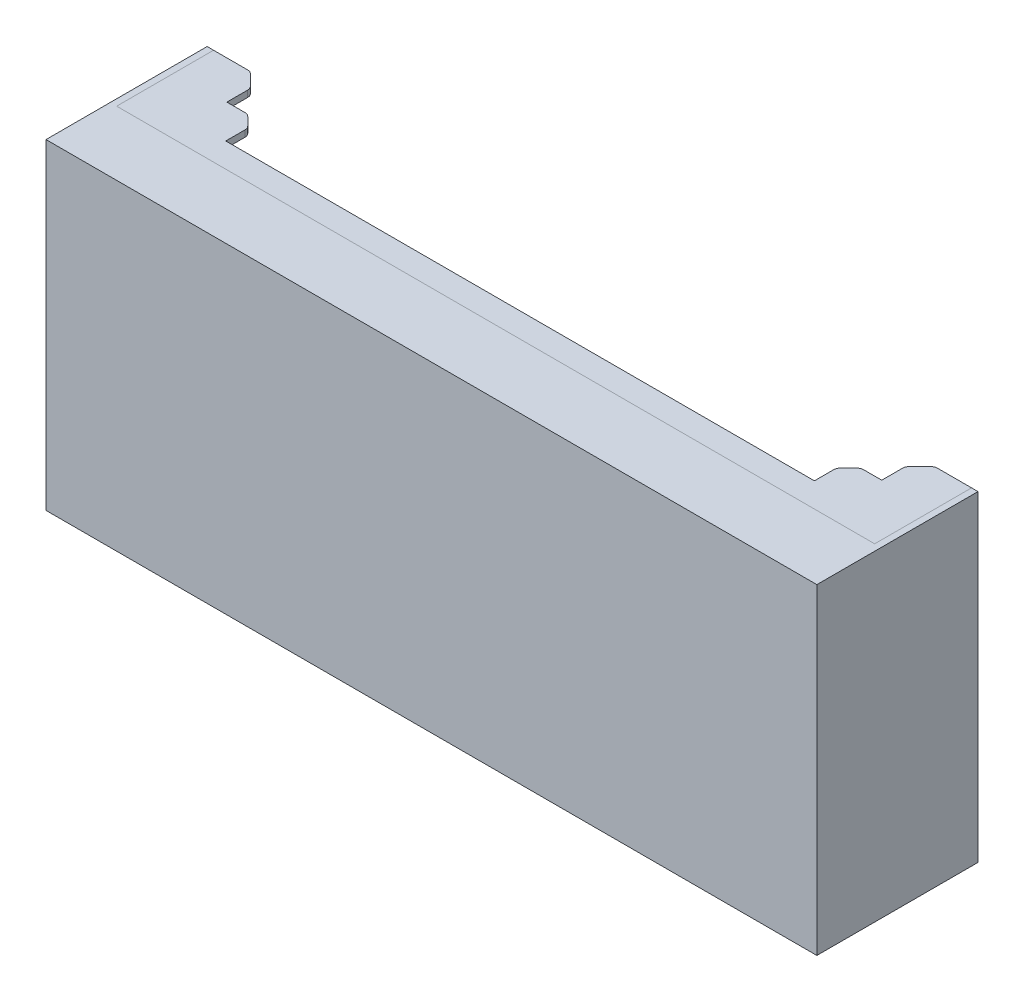
from build123d import *

# Parameters (mm, degrees)
SKETCH2_W            = 120
SKETCH2_H            = 50
BOSS_EXTRUDE1_DEPTH  = 10
SKETCH5_W            = 120
SKETCH5_H            = 1
BOSS_EXTRUDE2_DEPTH  = 15
SKETCH6_W            = 15.086263202
SKETCH6_H            = 50
BOSS_EXTRUDE5_DEPTH  = 1
SKETCH7_W            = 15.086263202
SKETCH7_H            = 50
BOSS_EXTRUDE6_DEPTH  = 1
BOSS_EXTRUDE7_DEPTH  = 1
LPATTERN2_COUNT      = 2
LPATTERN2_PITCH      = 50
FILLET1_R            = 1
FILLET2_R            = 1
SKETCH10_R           = 4
BOSS_EXTRUDE8_DEPTH  = 1
SKETCH11_R           = 4
BOSS_EXTRUDE10_DEPTH = 1
SKETCH12_R           = 1
BOSS_EXTRUDE11_DEPTH = 0.5
SKETCH13_W           = 3.178775998
SKETCH13_H           = 3.223697934
SKETCH13_H_2         = 3.223697935
BOSS_EXTRUDE12_DEPTH = 0.5
BOSS_EXTRUDE13_DEPTH = 3.2
BOSS_EXTRUDE15_DEPTH = 3.2


with BuildPart() as part:
    # Sketch2 → Boss-Extrude1 (new body)
    with BuildSketch(Plane.XY):
        with Locations((-60, 25)):
            Rectangle(SKETCH2_W, SKETCH2_H)
    extrude(amount=BOSS_EXTRUDE1_DEPTH)

    # Sketch5 → Boss-Extrude2 (add)
    with BuildSketch(Plane(origin=(0, 0, 0), x_dir=(-1, 0, 0), z_dir=(0, 0, -1))):
        with Locations((60, 22.926780628)):
            Rectangle(SKETCH5_W, SKETCH5_H)
    extrude(amount=BOSS_EXTRUDE2_DEPTH)

    # Sketch6 → Boss-Extrude5 (add)
    with BuildSketch(Plane(origin=(0, 0, 0), x_dir=(0, 0, -1), z_dir=(1, 0, 0))):
        with Locations((7.543131601, 25)):
            Rectangle(SKETCH6_W, SKETCH6_H)
    extrude(amount=-BOSS_EXTRUDE5_DEPTH)

    # Sketch7 → Boss-Extrude6 (add)
    with BuildSketch(Plane.ZY.offset(120)):
        with Locations((-7.543131601, 25)):
            Rectangle(SKETCH7_W, SKETCH7_H)
    extrude(amount=-BOSS_EXTRUDE6_DEPTH)

    # Sketch10 → Boss-Extrude8 (add)
    with BuildSketch(Plane.ZY.offset(1)):
        with Locations(Location((-7.543131601, 36.713390314, 0), (0, 0, 180))):
            Circle(SKETCH10_R)
    extrude(amount=BOSS_EXTRUDE8_DEPTH)

    # Sketch11 → Boss-Extrude10 (add)
    with BuildSketch(Plane.ZY.offset(1)):
        with Locations(Location((-7.5215658, 11.213390314, 0), (0, 0, 180))):
            Circle(SKETCH11_R)
    extrude(amount=BOSS_EXTRUDE10_DEPTH)

    # Sketch12 → Boss-Extrude11 (add)
    with BuildSketch(Plane.ZY.offset(2)):
        with Locations((-7.543131601, 36.713390314)):
            Circle(SKETCH12_R)
        with Locations((-7.5215658, 11.213390314)):
            Circle(SKETCH12_R)
    extrude(amount=BOSS_EXTRUDE11_DEPTH)

    # Sketch13 → Boss-Extrude12 (add)
    with BuildSketch(Plane(origin=(-119, 0, 0), x_dir=(0, 0, -1), z_dir=(1, 0, 0))):
        with Locations((9.116474982, 37.875113353)):
            Rectangle(SKETCH13_W, SKETCH13_H)
        with Locations((9.089387999, 13.602585939)):
            Rectangle(SKETCH13_W, SKETCH13_H_2)
    extrude(amount=BOSS_EXTRUDE12_DEPTH)

    # Sketch14 → Boss-Extrude13 (add)
    with BuildSketch(Plane(origin=(0, 39.48696232, 0), x_dir=(1, 0, 0), z_dir=(0, 1, 0))):
        Polygon((-118.5, 10.705862981), (-118.03582127, 10.40955065), (-118.03582127, 9.44156523), (-118.03582127, 8.346630902), (-118.5, 8.346630902), align=None)
    extrude(amount=-BOSS_EXTRUDE13_DEPTH)

    # Sketch15 → Boss-Extrude15 (add)
    with BuildSketch(Plane.XZ.offset(-11.990736971)):
        Polygon((-118.5, -10.678775998), (-118.5, -8.318775998), (-118.142191313, -8.618775998), (-118.142191313, -10.678775998), align=None)
    extrude(amount=-BOSS_EXTRUDE15_DEPTH)


with BuildPart() as body_2:
    # Sketch9 → Boss-Extrude7 (new body)
    with BuildSketch(Plane.XZ):
        Polygon((-6.732051107, -15.086263202), (-1, -15.086263202), (-1, 0), (-14.183064322, 0), (-60, 0), (-60, -3.801343331), (-14.183064322, -3.801343331), (-14.183064322, -7.224562619), (-12.279477372, -9.12814957), (-9.026587083, -9.12814957), (-9.026587083, -12.791727226), align=None)
        Polygon((-60, -3.801343331), (-60, 0), (-105.816935678, 0), (-119, 0), (-119, -15.086263202), (-113.267948893, -15.086263202), (-110.973412917, -12.791727226), (-110.973412917, -9.12814957), (-107.720522628, -9.12814957), (-105.816935678, -7.224562619), (-105.816935678, -3.801343331), align=None)
    boss_extrude7 = extrude(amount=BOSS_EXTRUDE7_DEPTH)

    # Fillet2
    fillet2_edges = [body_2.edges().sort_by_distance(p)[0] for p in [
        (-105.816935678, -0.5, -7.224562619),
        (-107.720522628, -0.5, -9.12814957),
        (-110.973412917, -0.5, -12.791727226),
        (-113.267948893, -0.5, -15.086263202),
        (-6.732051107, -0.5, -15.086263202),
        (-9.026587083, -0.5, -12.791727226),
        (-12.279477372, -0.5, -9.12814957),
        (-14.183064322, -0.5, -7.224562619),
    ]]
    fillet(fillet2_edges, radius=FILLET2_R)


with BuildPart() as lpattern2_1:
    # LPattern2: Boss-Extrude7 ×2
    with Locations(*[(0, i * LPATTERN2_PITCH, 0) for i in range(1, LPATTERN2_COUNT)]):
        add(boss_extrude7)

    # Fillet1
    fillet1_edges = [lpattern2_1.edges().sort_by_distance(p)[0] for p in [
        (-105.816935678, 49.5, -7.224562619),
        (-107.720522628, 49.5, -9.12814957),
        (-110.973412917, 49.5, -12.791727226),
        (-113.267948893, 49.5, -15.086263202),
        (-6.732051107, 49.5, -15.086263202),
        (-9.026587083, 49.5, -12.791727226),
        (-12.279477372, 49.5, -9.12814957),
        (-14.183064322, 49.5, -7.224562619),
    ]]
    fillet(fillet1_edges, radius=FILLET1_R)


solid = Compound([part.part, body_2.part, lpattern2_1.part])
